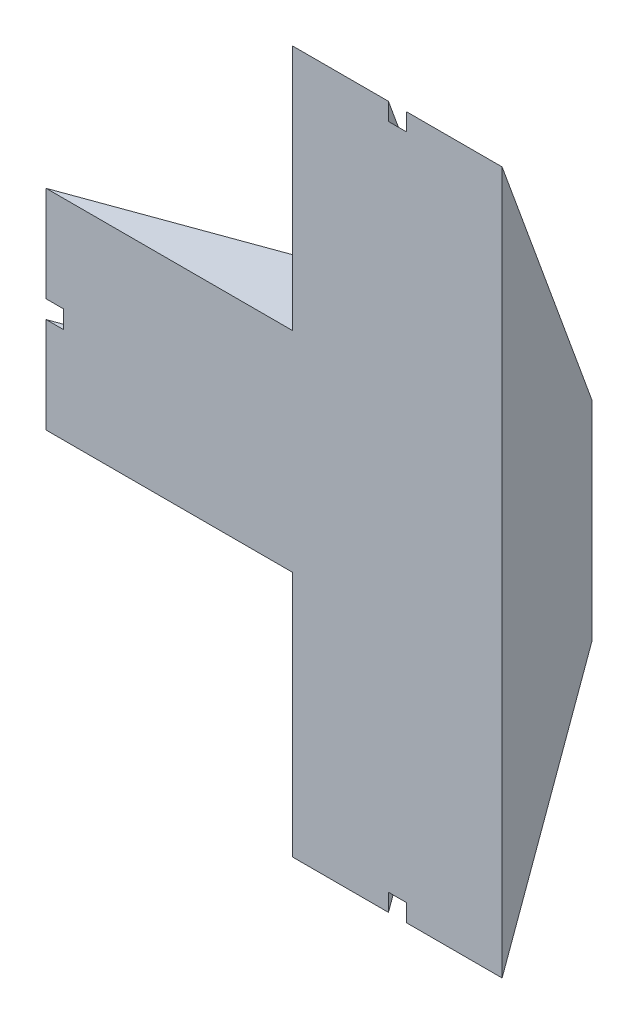
from build123d import *

# Parameters (mm, degrees)
BOSS_EXTRUDE1_DEPTH = 350
SKETCH2_W           = 150
SKETCH2_H           = 350
BOSS_EXTRUDE2_DEPTH = 350
BOSS_EXTRUDE3_DEPTH = 350
BOSS_EXTRUDE4_DEPTH = 350
SKETCH6_W           = 438.570660024
SKETCH6_H           = 30
CUT_EXTRUDE1_DEPTH  = 10
CUT_EXTRUDE2_DEPTH  = 10
SKETCH8_W           = 30
SKETCH8_H           = 438.570660025
CUT_EXTRUDE3_DEPTH  = 10
SKETCH9_W           = 30
SKETCH9_H           = 438.570660025
CUT_EXTRUDE4_DEPTH  = 10


with BuildPart() as part:
    # Sketch1 → Boss-Extrude1 (new body)
    with BuildSketch(Plane(origin=(0, 0, 0), x_dir=(1, 0, 0), z_dir=(0, 1, 0))):
        Polygon((0, 0), (412.121612918, 0), (412.121612918, 150), align=None)
    extrude(amount=BOSS_EXTRUDE1_DEPTH)

    # Sketch2 → Boss-Extrude2 (add)
    with BuildSketch(Plane(origin=(412.121612918, 0, 0), x_dir=(0, 0, -1), z_dir=(1, 0, 0))):
        with Locations((75, 175)):
            Rectangle(SKETCH2_W, SKETCH2_H)
    extrude(amount=BOSS_EXTRUDE2_DEPTH)

    # Sketch4 → Boss-Extrude3 (add)
    with BuildSketch(Plane(origin=(762.121612918, 0, 0), x_dir=(0, 0, -1), z_dir=(1, 0, 0))):
        Polygon((0, 762.121612918), (150, 350), (0, 350), align=None)
    extrude(amount=-BOSS_EXTRUDE3_DEPTH)

    # Sketch5 → Boss-Extrude4 (add)
    with BuildSketch(Plane(origin=(762.121612918, 0, 0), x_dir=(0, 0, -1), z_dir=(1, 0, 0))):
        Polygon((0, 0), (0, -412.121612918), (150, 0), align=None)
    extrude(amount=-BOSS_EXTRUDE4_DEPTH)

    # Sketch6 → Cut-Extrude1 (cut)
    with BuildSketch(Plane(origin=(0, 0, 0), x_dir=(-0.9396926207859104, 0, 0.34202014332566316), z_dir=(-0.34202014332566316, 0, -0.9396926207859104))):
        with Locations((-219.285330012, 175)):
            Rectangle(SKETCH6_W, SKETCH6_H)
    extrude(amount=-CUT_EXTRUDE1_DEPTH, mode=Mode.SUBTRACT)

    # Sketch7 → Cut-Extrude2 (cut)
    with BuildSketch(Plane(origin=(0, 0, -150), x_dir=(-1, 0, 0), z_dir=(0, 0, -1))):
        Polygon((-412.121612918, 190), (-572.121612918, 190), (-572.121612918, 350), (-602.121612918, 350), (-602.121612918, 190), (-602.121612918, 164.900861359), (-602.121612918, 160), (-602.121612918, 0), (-572.121612918, 0), (-572.121612918, 160), (-412.121612918, 160), align=None)
    extrude(amount=-CUT_EXTRUDE2_DEPTH, mode=Mode.SUBTRACT)

    # Sketch8 → Cut-Extrude3 (cut)
    with BuildSketch(Plane(origin=(0, -48.209070726, -132.453333234), x_dir=(-1, 0, 0), z_dir=(0, -0.34202014332566283, -0.9396926207859106))):
        with Locations((-587.121612918, -167.982308514)):
            Rectangle(SKETCH8_W, SKETCH8_H)
    extrude(amount=-CUT_EXTRUDE3_DEPTH, mode=Mode.SUBTRACT)

    # Sketch9 → Cut-Extrude4 (cut)
    with BuildSketch(Plane(origin=(0, 89.151293181, -244.941164929), x_dir=(-1, 0, 0), z_dir=(0, 0.342020143325663, -0.9396926207859105))):
        with Locations((-587.121612918, 496.874725788)):
            Rectangle(SKETCH9_W, SKETCH9_H)
    extrude(amount=-CUT_EXTRUDE4_DEPTH, mode=Mode.SUBTRACT)


solid = part.part
